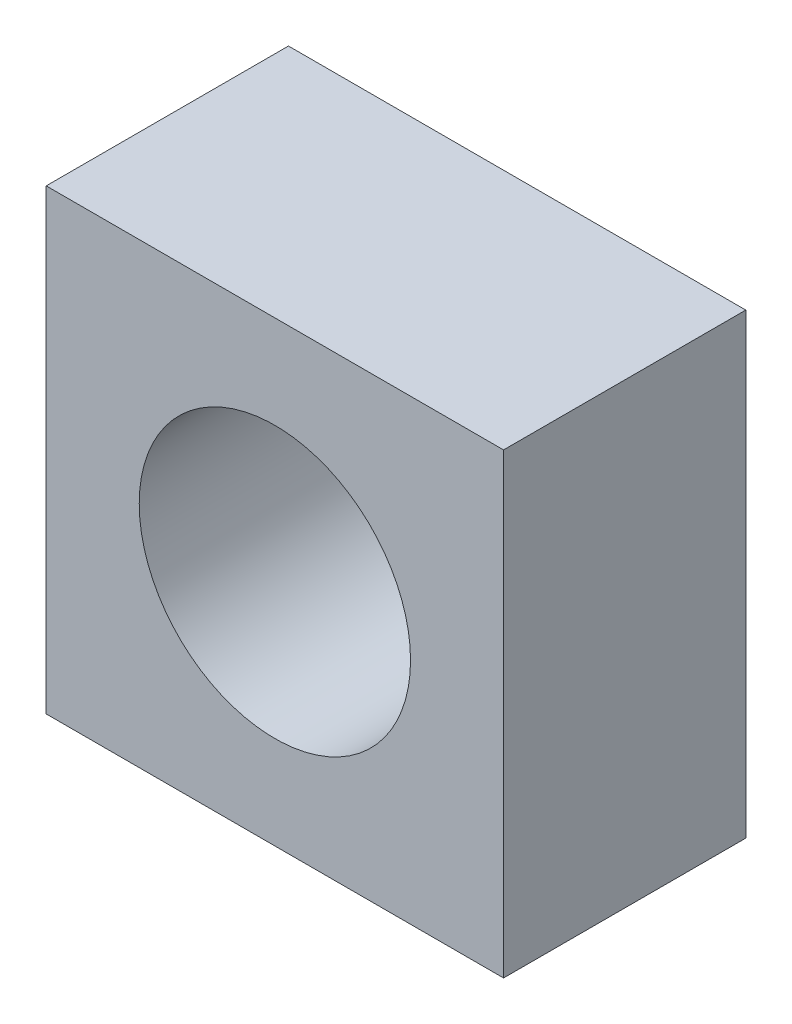
from build123d import *

# Parameters (mm, degrees)
SKETCH1_W           = 5.9944
SKETCH1_H           = 5.9944
BOSS_EXTRUDE1_DEPTH = 3.175
SKETCH2_R           = 1.778
CUT_EXTRUDE1_DEPTH  = 3.175


with BuildPart() as part:
    # Sketch1 → Boss-Extrude1 (new body)
    with BuildSketch(Plane.XY):
        Rectangle(SKETCH1_W, SKETCH1_H)
    extrude(amount=BOSS_EXTRUDE1_DEPTH)

    # Sketch2 → Cut-Extrude1 (cut)
    with BuildSketch(Plane.XY.offset(3.175)):
        Circle(SKETCH2_R)
    extrude(amount=-CUT_EXTRUDE1_DEPTH, mode=Mode.SUBTRACT)


solid = part.part
